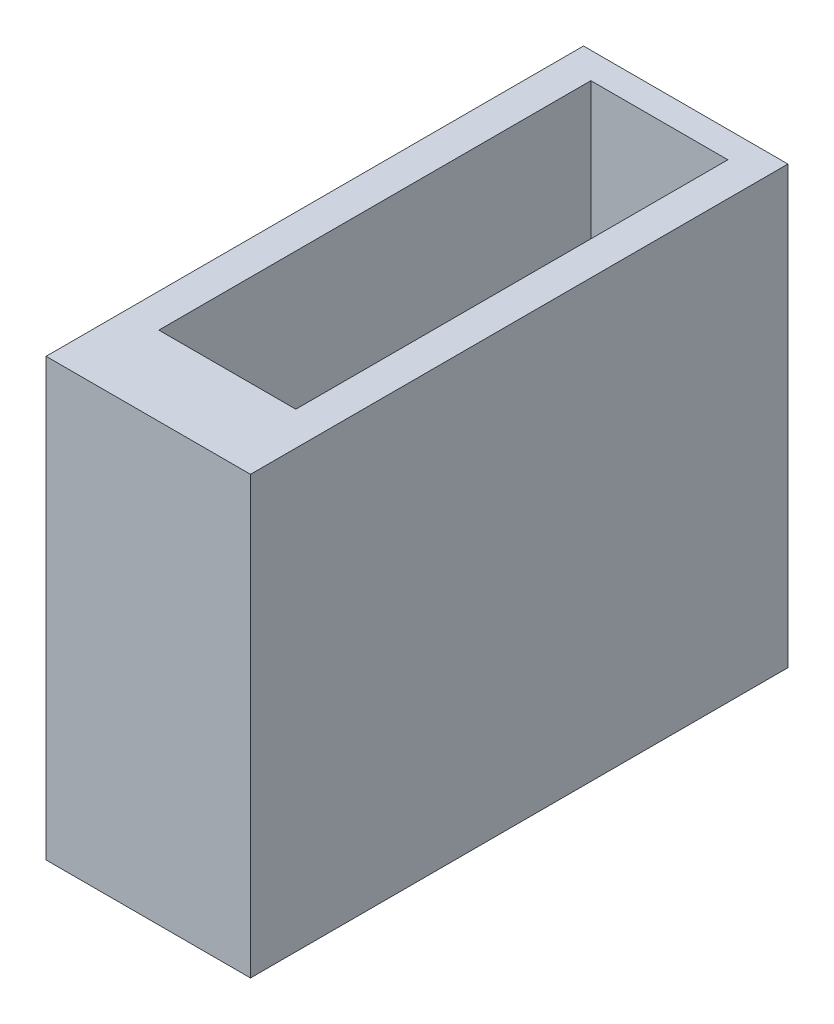
from build123d import *

# Parameters (mm, degrees)
SKETCH1_W           = 38.8
SKETCH1_H           = 82.79
BOSS_EXTRUDE1_DEPTH = 102
SKETCH2_W           = 26
SKETCH2_H           = 82
CUT_EXTRUDE1_DEPTH  = 135.098752639


with BuildPart() as part:
    # Sketch1 → Boss-Extrude1 (new body)
    with BuildSketch(Plane.XY):
        with Locations((-7.512661692, -14.110789474)):
            Rectangle(SKETCH1_W, SKETCH1_H)
    extrude(amount=BOSS_EXTRUDE1_DEPTH)

    # Sketch2 → Cut-Extrude1 (cut, through all)
    with BuildSketch(Plane.XZ.offset(55.505789474)):
        with Locations((-7.512661692, 46)):
            Rectangle(SKETCH2_W, SKETCH2_H)
    extrude(amount=-CUT_EXTRUDE1_DEPTH, mode=Mode.SUBTRACT)


solid = part.part
